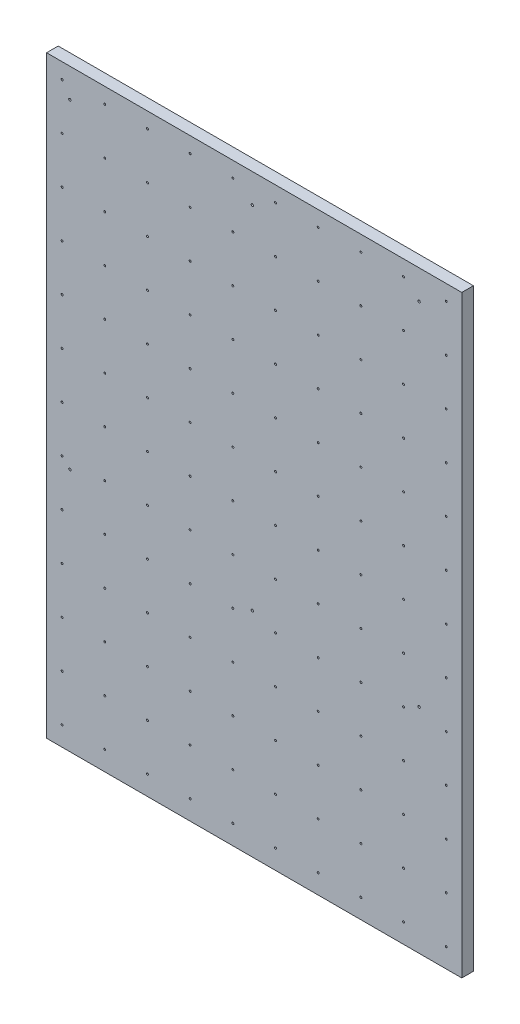
from build123d import *

# Parameters (mm, degrees)
SKETCH_1_W          = 1070
SKETCH_1_H          = 1530
EXTRUDE_1_DEPTH     = 15
SKETCH_2_R          = 2.5
CUT_EXTRUDE_1_DEPTH = 934.996788003
SKETCH_3_R          = 3
CUT_EXTRUDE_2_DEPTH = 934.996788003


with BuildPart() as part:
    # Эскиз1 → Бобышка-Вытянуть1 (new, symmetric)
    with BuildSketch(Plane.XY):
        Rectangle(SKETCH_1_W, SKETCH_1_H)
    extrude(amount=EXTRUDE_1_DEPTH, both=True)

    # Эскиз2 → Вырез-Вытянуть1 (cut, through all)
    with BuildSketch(Plane.XY.offset(15)):
        with Locations((-495, 725)):
            Circle(SKETCH_2_R)
        with Locations((-385, 725)):
            Circle(SKETCH_2_R)
        with Locations((-275, 725)):
            Circle(SKETCH_2_R)
        with Locations((-165, 725)):
            Circle(SKETCH_2_R)
        with Locations((-55, 725)):
            Circle(SKETCH_2_R)
        with Locations((55, 725)):
            Circle(SKETCH_2_R)
        with Locations((165, 725)):
            Circle(SKETCH_2_R)
        with Locations((275, 725)):
            Circle(SKETCH_2_R)
        with Locations((385, 725)):
            Circle(SKETCH_2_R)
        with Locations((495, 725)):
            Circle(SKETCH_2_R)
        with Locations((-385, 605)):
            Circle(SKETCH_2_R)
        with Locations((-275, 605)):
            Circle(SKETCH_2_R)
        with Locations((-165, 605)):
            Circle(SKETCH_2_R)
        with Locations((-55, 605)):
            Circle(SKETCH_2_R)
        with Locations((55, 605)):
            Circle(SKETCH_2_R)
        with Locations((165, 605)):
            Circle(SKETCH_2_R)
        with Locations((275, 605)):
            Circle(SKETCH_2_R)
        with Locations((385, 605)):
            Circle(SKETCH_2_R)
        with Locations((495, 605)):
            Circle(SKETCH_2_R)
        with Locations((-385, 485)):
            Circle(SKETCH_2_R)
        with Locations((-275, 485)):
            Circle(SKETCH_2_R)
        with Locations((-165, 485)):
            Circle(SKETCH_2_R)
        with Locations((-55, 485)):
            Circle(SKETCH_2_R)
        with Locations((55, 485)):
            Circle(SKETCH_2_R)
        with Locations((165, 485)):
            Circle(SKETCH_2_R)
        with Locations((275, 485)):
            Circle(SKETCH_2_R)
        with Locations((385, 485)):
            Circle(SKETCH_2_R)
        with Locations((495, 485)):
            Circle(SKETCH_2_R)
        with Locations((-385, 365)):
            Circle(SKETCH_2_R)
        with Locations((-275, 365)):
            Circle(SKETCH_2_R)
        with Locations((-165, 365)):
            Circle(SKETCH_2_R)
        with Locations((-55, 365)):
            Circle(SKETCH_2_R)
        with Locations((55, 365)):
            Circle(SKETCH_2_R)
        with Locations((165, 365)):
            Circle(SKETCH_2_R)
        with Locations((275, 365)):
            Circle(SKETCH_2_R)
        with Locations((385, 365)):
            Circle(SKETCH_2_R)
        with Locations((495, 365)):
            Circle(SKETCH_2_R)
        with Locations((-385, 245)):
            Circle(SKETCH_2_R)
        with Locations((-275, 245)):
            Circle(SKETCH_2_R)
        with Locations((-165, 245)):
            Circle(SKETCH_2_R)
        with Locations((-55, 245)):
            Circle(SKETCH_2_R)
        with Locations((55, 245)):
            Circle(SKETCH_2_R)
        with Locations((165, 245)):
            Circle(SKETCH_2_R)
        with Locations((275, 245)):
            Circle(SKETCH_2_R)
        with Locations((385, 245)):
            Circle(SKETCH_2_R)
        with Locations((495, 245)):
            Circle(SKETCH_2_R)
        with Locations((-385, 125)):
            Circle(SKETCH_2_R)
        with Locations((-275, 125)):
            Circle(SKETCH_2_R)
        with Locations((-165, 125)):
            Circle(SKETCH_2_R)
        with Locations((-55, 125)):
            Circle(SKETCH_2_R)
        with Locations((55, 125)):
            Circle(SKETCH_2_R)
        with Locations((165, 125)):
            Circle(SKETCH_2_R)
        with Locations((275, 125)):
            Circle(SKETCH_2_R)
        with Locations((385, 125)):
            Circle(SKETCH_2_R)
        with Locations((495, 125)):
            Circle(SKETCH_2_R)
        with Locations((-385, 5)):
            Circle(SKETCH_2_R)
        with Locations((-275, 5)):
            Circle(SKETCH_2_R)
        with Locations((-165, 5)):
            Circle(SKETCH_2_R)
        with Locations((-55, 5)):
            Circle(SKETCH_2_R)
        with Locations((55, 5)):
            Circle(SKETCH_2_R)
        with Locations((165, 5)):
            Circle(SKETCH_2_R)
        with Locations((275, 5)):
            Circle(SKETCH_2_R)
        with Locations((385, 5)):
            Circle(SKETCH_2_R)
        with Locations((495, 5)):
            Circle(SKETCH_2_R)
        with Locations((-385, -115)):
            Circle(SKETCH_2_R)
        with Locations((-275, -115)):
            Circle(SKETCH_2_R)
        with Locations((-165, -115)):
            Circle(SKETCH_2_R)
        with Locations((-55, -115)):
            Circle(SKETCH_2_R)
        with Locations((55, -115)):
            Circle(SKETCH_2_R)
        with Locations((165, -115)):
            Circle(SKETCH_2_R)
        with Locations((275, -115)):
            Circle(SKETCH_2_R)
        with Locations((385, -115)):
            Circle(SKETCH_2_R)
        with Locations((495, -115)):
            Circle(SKETCH_2_R)
        with Locations((-385, -235)):
            Circle(SKETCH_2_R)
        with Locations((-275, -235)):
            Circle(SKETCH_2_R)
        with Locations((-165, -235)):
            Circle(SKETCH_2_R)
        with Locations((-55, -235)):
            Circle(SKETCH_2_R)
        with Locations((55, -235)):
            Circle(SKETCH_2_R)
        with Locations((165, -235)):
            Circle(SKETCH_2_R)
        with Locations((275, -235)):
            Circle(SKETCH_2_R)
        with Locations((385, -235)):
            Circle(SKETCH_2_R)
        with Locations((495, -235)):
            Circle(SKETCH_2_R)
        with Locations((-385, -355)):
            Circle(SKETCH_2_R)
        with Locations((-275, -355)):
            Circle(SKETCH_2_R)
        with Locations((-165, -355)):
            Circle(SKETCH_2_R)
        with Locations((-55, -355)):
            Circle(SKETCH_2_R)
        with Locations((55, -355)):
            Circle(SKETCH_2_R)
        with Locations((165, -355)):
            Circle(SKETCH_2_R)
        with Locations((275, -355)):
            Circle(SKETCH_2_R)
        with Locations((385, -355)):
            Circle(SKETCH_2_R)
        with Locations((495, -355)):
            Circle(SKETCH_2_R)
        with Locations((-385, -475)):
            Circle(SKETCH_2_R)
        with Locations((-275, -475)):
            Circle(SKETCH_2_R)
        with Locations((-165, -475)):
            Circle(SKETCH_2_R)
        with Locations((-55, -475)):
            Circle(SKETCH_2_R)
        with Locations((55, -475)):
            Circle(SKETCH_2_R)
        with Locations((165, -475)):
            Circle(SKETCH_2_R)
        with Locations((275, -475)):
            Circle(SKETCH_2_R)
        with Locations((385, -475)):
            Circle(SKETCH_2_R)
        with Locations((495, -475)):
            Circle(SKETCH_2_R)
        with Locations((-385, -595)):
            Circle(SKETCH_2_R)
        with Locations((-275, -595)):
            Circle(SKETCH_2_R)
        with Locations((-165, -595)):
            Circle(SKETCH_2_R)
        with Locations((-55, -595)):
            Circle(SKETCH_2_R)
        with Locations((55, -595)):
            Circle(SKETCH_2_R)
        with Locations((165, -595)):
            Circle(SKETCH_2_R)
        with Locations((275, -595)):
            Circle(SKETCH_2_R)
        with Locations((385, -595)):
            Circle(SKETCH_2_R)
        with Locations((495, -595)):
            Circle(SKETCH_2_R)
        with Locations((-385, -715)):
            Circle(SKETCH_2_R)
        with Locations((-275, -715)):
            Circle(SKETCH_2_R)
        with Locations((-165, -715)):
            Circle(SKETCH_2_R)
        with Locations((-55, -715)):
            Circle(SKETCH_2_R)
        with Locations((55, -715)):
            Circle(SKETCH_2_R)
        with Locations((165, -715)):
            Circle(SKETCH_2_R)
        with Locations((275, -715)):
            Circle(SKETCH_2_R)
        with Locations((385, -715)):
            Circle(SKETCH_2_R)
        with Locations((495, -715)):
            Circle(SKETCH_2_R)
        with Locations((-495, 605)):
            Circle(SKETCH_2_R)
        with Locations((-495, 485)):
            Circle(SKETCH_2_R)
        with Locations((-495, 365)):
            Circle(SKETCH_2_R)
        with Locations((-495, 245)):
            Circle(SKETCH_2_R)
        with Locations((-495, 125)):
            Circle(SKETCH_2_R)
        with Locations((-495, 5)):
            Circle(SKETCH_2_R)
        with Locations((-495, -115)):
            Circle(SKETCH_2_R)
        with Locations((-495, -235)):
            Circle(SKETCH_2_R)
        with Locations((-495, -355)):
            Circle(SKETCH_2_R)
        with Locations((-495, -475)):
            Circle(SKETCH_2_R)
        with Locations((-495, -595)):
            Circle(SKETCH_2_R)
        with Locations((-495, -715)):
            Circle(SKETCH_2_R)
    extrude(amount=-CUT_EXTRUDE_1_DEPTH, mode=Mode.SUBTRACT)

    # Эскиз3 → Вырез-Вытянуть2 (cut, through all)
    with BuildSketch(Plane.XY.offset(15)):
        with Locations((-475, 690)):
            Circle(SKETCH_3_R)
        with Locations((-5, 690)):
            Circle(SKETCH_3_R)
        with Locations((425, 690)):
            Circle(SKETCH_3_R)
        with Locations((-475, -135)):
            Circle(SKETCH_3_R)
        with Locations((-5, -215)):
            Circle(SKETCH_3_R)
        with Locations((425, -215)):
            Circle(SKETCH_3_R)
    extrude(amount=-CUT_EXTRUDE_2_DEPTH, mode=Mode.SUBTRACT)


solid = part.part
